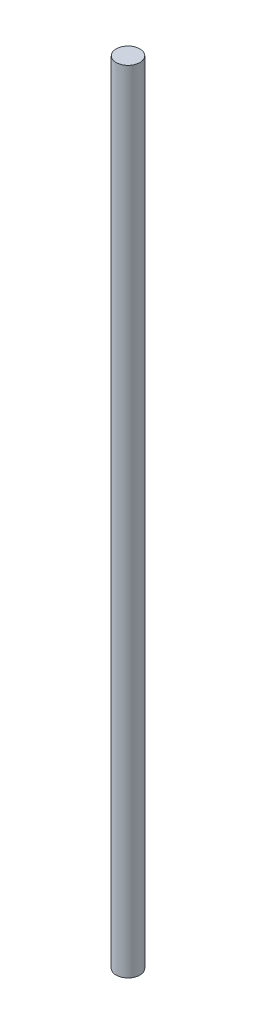
from build123d import *

# Parameters (mm, degrees)
SKETCH1_R           = 3
BOSS_EXTRUDE1_DEPTH = 200


with BuildPart() as part:
    # Sketch1 → Boss-Extrude1 (new body)
    with BuildSketch(Plane(origin=(0, 0, 0), x_dir=(1, 0, 0), z_dir=(0, 1, 0))):
        with Locations(Location((-5.326822835, 0, 0), (0, 0, 270))):
            Circle(SKETCH1_R)
    extrude(amount=BOSS_EXTRUDE1_DEPTH)


solid = part.part
